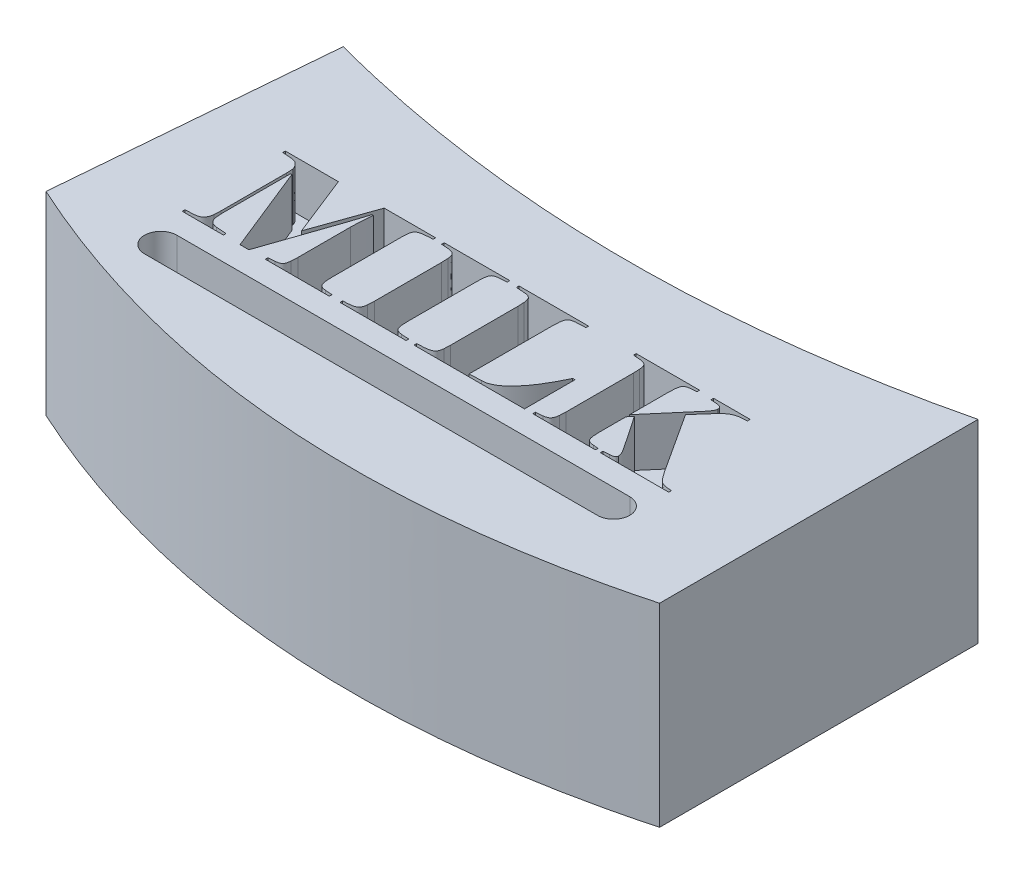
from build123d import *

# Parameters (mm, degrees)
BOSS_EXTRUDE1_DEPTH = 30.48
CUT_EXTRUDE1_DEPTH  = 7.62
SKETCH5_W           = 0.284935897
SKETCH5_H           = 2.320192308
SKETCH5_W_2         = 0.284935898
SKETCH5_H_2         = 3.256410256
CUT_EXTRUDE2_DEPTH  = 7.62
CUT_EXTRUDE3_DEPTH  = 15.24


with BuildPart() as part:
    # Sketch1 → Boss-Extrude1 (new body)
    with BuildSketch(Plane(origin=(0, 0, 0), x_dir=(1, 0, 0), z_dir=(0, 1, 0))):
        with BuildLine():
            Line((104.174952368, 42.174080227), (104.174952368, -7.827915506))
            add(Edge.make_bspline(
                [(0, 0), (49.417623471, -22.553771627), (104.174952368, -7.827915506)],
                knots=[0, 0, 0, 1, 1, 1], degree=2))
            Line((0, 0), (3.65048177, 43.025415545))
            add(Edge.make_bspline(
                [(3.65048177, 43.025415545), (53.087857537, 29.832692658), (104.174952368, 42.174080227)],
                knots=[0, 0, 0, 1, 1, 1], degree=2))
        make_face()
    extrude(amount=BOSS_EXTRUDE1_DEPTH)

    # Sketch2 → Cut-Extrude1 (cut)
    with BuildSketch(Plane(origin=(0, 30.48, 0), x_dir=(1, 0, 0), z_dir=(0, 1, 0))):
        with BuildLine():
            Line((16.79579589, 21.602120477), (16.79579589, 11.13742765))
            Line((16.79579589, 11.13742765), (16.840902325, 10.064538884))
            add(Edge.make_bspline(
                [(16.840902325, 10.064538884), (16.855310818, 9.951271918), (16.882521555, 9.737364909), (16.963560104, 9.440350461), (17.071528194, 9.185751), (17.212865002, 8.969886563), (17.4001947, 8.794697297), (17.641767838, 8.668410244), (17.926440796, 8.565971392), (18.137332085, 8.534615787), (18.248867462, 8.518032555)],
                knots=[0, 0, 0, 0, 1.180791605, 2.229949378, 3.175900595, 4.033087221, 4.882670352, 5.798347502, 6.835598461, 8, 8, 8, 8], degree=3))
            Line((18.248867462, 8.518032555), (19.863033443, 8.405266469))
            Line((19.863033443, 8.405266469), (19.863033443, 7.992864781))
            Line((19.863033443, 7.992864781), (13.396703855, 7.992864781))
            Line((13.396703855, 7.992864781), (13.396703855, 8.405266469))
            add(Edge.make_bspline(
                [(13.396703855, 8.405266469), (13.512654403, 8.412536722), (13.75409792, 8.427675551), (14.140285262, 8.434680181), (14.582254193, 8.466480019), (14.987786193, 8.508590057), (15.329401546, 8.576719314), (15.569068053, 8.66968946), (15.776891591, 8.80621234), (15.956971201, 8.978493607), (16.10265307, 9.19210614), (16.215610302, 9.443088637), (16.300736034, 9.731257059), (16.325374784, 9.93936279), (16.338287768, 10.048429443)],
                knots=[0, 0, 0, 0, 1.088681475, 2.266958535, 3.618688853, 5.240381737, 6.085350881, 6.875939365, 7.632479768, 8.401240364, 9.196937712, 10.039084781, 10.972299039, 12, 12, 12, 12], degree=3))
            Line((16.338287768, 10.048429443), (16.383394203, 11.111652545))
            Line((16.383394203, 11.111652545), (16.383394203, 21.408807186))
            Line((16.383394203, 21.408807186), (16.33506588, 22.426923853))
            add(Edge.make_bspline(
                [(16.33506588, 22.426923853), (16.306402965, 22.513882865), (16.250472812, 22.683566618), (16.12620791, 22.916199528), (15.990450227, 23.132012246), (15.824942796, 23.318623305), (15.640912401, 23.476982554), (15.44056532, 23.607287074), (15.215560008, 23.690474644), (14.898441998, 23.753342601), (14.49424637, 23.796948188), (14.094840672, 23.819721822), (13.794154822, 23.838505985), (13.599468927, 23.84552318), (13.435429878, 23.860475081), (13.335498797, 23.867264464), (13.290381544, 23.87032976)],
                knots=[0, 0, 0, 0, 1.040607395, 2.030544763, 2.993838035, 3.938318236, 4.857522136, 5.753242602, 6.643520453, 7.569370654, 9.429009052, 11.267416851, 12.124836776, 12.859487778, 13.485077342, 14, 14, 14, 14], degree=3))
            Line((13.290381544, 23.87032976), (13.290381544, 24.282731448))
            Line((13.290381544, 24.282731448), (21.628628169, 24.282731448))
            Line((21.628628169, 24.282731448), (25.417568675, 14.697614095))
            Line((25.417568675, 14.697614095), (28.819882599, 24.282731448))
            Line((28.819882599, 24.282731448), (36.900378169, 24.282731448))
            Line((36.900378169, 24.282731448), (36.900378169, 23.87032976))
            Line((36.900378169, 23.87032976), (36.388097947, 23.87032976))
            add(Edge.make_bspline(
                [(36.388097947, 23.87032976), (36.340839077, 23.868301293), (36.226918545, 23.863411542), (36.025804525, 23.851094398), (35.765108539, 23.822708689), (35.461428878, 23.791851935), (35.153953046, 23.747453099), (34.880712532, 23.675318462), (34.662135753, 23.576817252), (34.487865641, 23.452863269), (34.357694562, 23.286619329), (34.270097108, 23.074169735), (34.192463447, 22.821264509), (34.17038938, 22.633787711), (34.158551323, 22.533246163)],
                knots=[0, 0, 0, 0, 0.574857276, 1.38573024, 2.448042293, 3.761060899, 5.095696551, 6.219790428, 7.183303074, 7.995120805, 8.794143213, 9.711188391, 10.772537914, 12, 12, 12, 12], degree=3))
            Line((34.158551323, 22.533246163), (34.116666777, 21.602120477))
            Line((34.116666777, 21.602120477), (34.116666777, 10.908673589))
            Line((34.116666777, 10.908673589), (34.158551323, 9.871225593))
            add(Edge.make_bspline(
                [(34.158551323, 9.871225593), (34.171579831, 9.760314005), (34.195797157, 9.554152096), (34.257998274, 9.273516008), (34.340398601, 9.04519163), (34.448252442, 8.861112477), (34.608137462, 8.721668446), (34.819915399, 8.624114431), (35.083066641, 8.54212294), (35.279127061, 8.511943938), (35.386090722, 8.495479338)],
                knots=[0, 0, 0, 0, 1.288094477, 2.394303626, 3.308027556, 4.081698434, 4.827785203, 5.714472145, 6.753096487, 8, 8, 8, 8], degree=3))
            Line((35.386090722, 8.495479338), (36.497642146, 8.405266469))
            Line((36.497642146, 8.405266469), (36.497642146, 7.992864781))
            Line((36.497642146, 7.992864781), (26.435685342, 7.992864781))
            Line((26.435685342, 7.992864781), (26.435685342, 8.405266469))
            Line((26.435685342, 8.405266469), (27.473133338, 8.472926121))
            add(Edge.make_bspline(
                [(27.473133338, 8.472926121), (27.582920835, 8.489389111), (27.783872718, 8.519522495), (28.055116766, 8.58534075), (28.262574512, 8.679456825), (28.427484537, 8.793638016), (28.533962178, 8.968432604), (28.615095479, 9.190213873), (28.672987315, 9.475081226), (28.697117781, 9.685215511), (28.710338401, 9.800344053)],
                knots=[0, 0, 0, 0, 1.287597348, 2.35678124, 3.220361743, 3.922644693, 4.640971293, 5.547472163, 6.656307056, 8, 8, 8, 8], degree=3))
            Line((28.710338401, 9.800344053), (28.755444836, 10.81846072))
            Line((28.755444836, 10.81846072), (28.755444836, 19.037497481))
            add(Edge.make_bspline(
                [(28.755444836, 19.037497481), (28.755864277, 19.156720244), (28.756744956, 19.407045731), (28.771648071, 19.797950743), (28.789650053, 20.221247074), (28.829998967, 20.817257997), (28.883298073, 21.556455972), (28.936132439, 22.143463296), (28.96164568, 22.426923853)],
                knots=[0, 0, 0, 0, 0.63174092, 1.326431708, 2.072751143, 2.876833313, 4.491850898, 6, 6, 6, 6], degree=3))
            Line((28.96164568, 22.426923853), (28.755444836, 22.426923853))
            Line((28.755444836, 22.426923853), (27.837206703, 19.559443367))
            Line((27.837206703, 19.559443367), (23.86461857, 7.992864781))
            Line((23.86461857, 7.992864781), (22.475984762, 7.992864781))
            Line((22.475984762, 7.992864781), (17.001996734, 21.602120477))
            Line((17.001996734, 21.602120477), (16.79579589, 21.602120477))
        make_face()
        with BuildLine():
            Line((48.54750396, 7.992864781), (38.17624589, 7.992864781))
            Line((38.17624589, 7.992864781), (38.17624589, 8.405266469))
            add(Edge.make_bspline(
                [(38.17624589, 8.405266469), (38.238534262, 8.40632636), (38.380311211, 8.408738818), (38.573761163, 8.412328381), (38.771491548, 8.424579714), (38.969972863, 8.445447223), (39.2118272, 8.470528964), (39.4821156, 8.503330758), (39.753787163, 8.547522986), (39.997443789, 8.623793821), (40.196182562, 8.728860881), (40.357547398, 8.865145165), (40.474736827, 9.046502978), (40.568175811, 9.269786078), (40.633043302, 9.543061937), (40.657096811, 9.742038618), (40.669987346, 9.848672376)],
                knots=[0, 0, 0, 0, 0.789504643, 1.79702176, 2.451582526, 3.299352473, 4.325902506, 5.53291431, 6.75024101, 7.809035357, 8.752954279, 9.582614002, 10.454618519, 11.46075579, 12.639191541, 14, 14, 14, 14], degree=3))
            Line((40.669987346, 9.848672376), (40.715093781, 10.866789042))
            Line((40.715093781, 10.866789042), (40.715093781, 21.408807186))
            Line((40.715093781, 21.408807186), (40.669987346, 22.426923853))
            add(Edge.make_bspline(
                [(40.669987346, 22.426923853), (40.658404814, 22.536815215), (40.636986149, 22.740028648), (40.573305431, 23.01747916), (40.489418132, 23.241574834), (40.379238556, 23.421838184), (40.219907386, 23.555934837), (40.01135974, 23.655669312), (39.748844998, 23.737063184), (39.552632328, 23.764927217), (39.445669836, 23.780116891)],
                knots=[0, 0, 0, 0, 1.286399132, 2.378836497, 3.30580034, 4.065758715, 4.810741072, 5.694751535, 6.743327228, 8, 8, 8, 8], degree=3))
            Line((39.445669836, 23.780116891), (38.243905542, 23.87032976))
            Line((38.243905542, 23.87032976), (38.243905542, 24.282731448))
            Line((38.243905542, 24.282731448), (48.54750396, 24.282731448))
            Line((48.54750396, 24.282731448), (48.54750396, 23.87032976))
            Line((48.54750396, 23.87032976), (47.345739667, 23.802670108))
            add(Edge.make_bspline(
                [(47.345739667, 23.802670108), (47.238990041, 23.79020542), (47.043934193, 23.767429601), (46.779786982, 23.700241305), (46.570380127, 23.611190202), (46.408712656, 23.486711115), (46.296718579, 23.311776106), (46.217950027, 23.084525907), (46.154449112, 22.798945043), (46.130980708, 22.587292295), (46.118200268, 22.472030287)],
                knots=[0, 0, 0, 0, 1.246782035, 2.278154386, 3.154322115, 3.872926938, 4.609589167, 5.529054493, 6.654370696, 8, 8, 8, 8], degree=3))
            Line((46.118200268, 22.472030287), (46.076315722, 21.450691732))
            Line((46.076315722, 21.450691732), (46.076315722, 10.824904496))
            Line((46.076315722, 10.824904496), (46.118200268, 9.803565941))
            add(Edge.make_bspline(
                [(46.118200268, 9.803565941), (46.130312655, 9.691361971), (46.152671169, 9.484242263), (46.224742413, 9.205710215), (46.309444672, 8.98039383), (46.432087596, 8.807241297), (46.603307786, 8.685043629), (46.817606191, 8.592029626), (47.084572528, 8.518057562), (47.280850368, 8.488827228), (47.387624213, 8.472926121)],
                knots=[0, 0, 0, 0, 1.301156279, 2.401832208, 3.313663941, 4.067576686, 4.811533303, 5.710459504, 6.754505129, 8, 8, 8, 8], degree=3))
            Line((47.387624213, 8.472926121), (48.54750396, 8.405266469))
            Line((48.54750396, 8.405266469), (48.54750396, 7.992864781))
        make_face()
        with BuildLine():
            add(Edge.make_bspline(
                [(59.949766249, 8.472926121), (60.06171071, 8.47662354), (60.286016634, 8.484032153), (60.622022607, 8.545515148), (60.956139618, 8.642629127), (61.291949057, 8.775033653), (61.622769438, 8.952249121), (61.957562766, 9.161606138), (62.287669324, 9.415184812), (62.73095601, 9.799493007), (63.259612979, 10.335449378), (63.86885719, 11.016820748), (64.433429847, 11.751344311), (64.955250266, 12.532851691), (65.449053793, 13.346679576), (65.918108395, 14.185170182), (66.369414247, 15.04315659), (66.646932878, 15.629856775), (66.786612979, 15.925153494)],
                knots=[0, 0, 0, 0, 0.509346161, 1.020589684, 1.549823793, 2.091867224, 2.660493313, 3.256000877, 3.887721917, 4.55329516, 5.925866832, 7.311293249, 8.712726772, 10.139342848, 11.587513804, 13.045482177, 14.512938222, 16, 16, 16, 16], degree=3))
            Line((66.786612979, 15.925153494), (67.144242568, 15.925153494))
            Line((67.144242568, 15.925153494), (67.144242568, 7.992864781))
            Line((67.144242568, 7.992864781), (49.787930912, 7.992864781))
            Line((49.787930912, 7.992864781), (49.787930912, 8.405266469))
            add(Edge.make_bspline(
                [(49.787930912, 8.405266469), (49.860959545, 8.406331785), (50.030657133, 8.408807276), (50.262738808, 8.412384062), (50.498083287, 8.424109456), (50.727714317, 8.445404776), (50.999660082, 8.470034548), (51.299922458, 8.503330876), (51.599151263, 8.547601124), (51.8684403, 8.623257886), (52.089746208, 8.72917308), (52.273501147, 8.862697204), (52.413223484, 9.042368218), (52.514407604, 9.269340773), (52.591662975, 9.541720277), (52.616416593, 9.741812752), (52.629636291, 9.848672376)],
                knots=[0, 0, 0, 0, 0.84529083, 1.964213326, 2.686082439, 3.571715602, 4.632883893, 5.846263634, 7.068207395, 8.130176101, 9.069644986, 9.894961127, 10.735486619, 11.669595784, 12.75544487, 14, 14, 14, 14], degree=3))
            Line((52.629636291, 9.848672376), (52.674742726, 10.866789042))
            Line((52.674742726, 10.866789042), (52.674742726, 21.408807186))
            Line((52.674742726, 21.408807186), (52.629636291, 22.426923853))
            add(Edge.make_bspline(
                [(52.629636291, 22.426923853), (52.617066685, 22.536884072), (52.593807683, 22.740356233), (52.526227245, 23.017415089), (52.440653427, 23.243520796), (52.322509931, 23.418185479), (52.175772357, 23.550148068), (51.998730257, 23.650093972), (51.788529234, 23.720403815), (51.478747294, 23.771827194), (51.103644045, 23.815809256), (50.689037655, 23.834348973), (50.326912971, 23.849162151), (50.101509663, 23.863499646), (49.994131755, 23.87032976)],
                knots=[0, 0, 0, 0, 1.147575469, 2.123492127, 2.95349405, 3.642940923, 4.289999017, 4.984025789, 5.738355238, 6.577808332, 8.238298583, 9.656019474, 10.88337165, 12, 12, 12, 12], degree=3))
            Line((49.994131755, 23.87032976), (49.994131755, 24.282731448))
            Line((49.994131755, 24.282731448), (60.922776481, 24.282731448))
            Line((60.922776481, 24.282731448), (60.922776481, 23.87032976))
            Line((60.922776481, 23.87032976), (59.373048264, 23.802670108))
            add(Edge.make_bspline(
                [(59.373048264, 23.802670108), (59.265261074, 23.790152817), (59.064782812, 23.766871343), (58.792538532, 23.698380073), (58.573558173, 23.603069173), (58.400881638, 23.475297284), (58.281233877, 23.295406441), (58.188727124, 23.070131866), (58.119466232, 22.787796511), (58.096646809, 22.578755607), (58.08429299, 22.465586511)],
                knots=[0, 0, 0, 0, 1.234540546, 2.296177721, 3.182553996, 3.940675153, 4.70390553, 5.607732982, 6.704891285, 8, 8, 8, 8], degree=3))
            Line((58.08429299, 22.465586511), (58.035964667, 21.43780418))
            Line((58.035964667, 21.43780418), (58.035964667, 8.405266469))
            Line((58.035964667, 8.405266469), (59.949766249, 8.472926121))
        make_face()
        with BuildLine():
            Line((76.790575796, 15.593299011), (76.181638928, 14.88448361))
            Line((76.181638928, 14.88448361), (76.181638928, 10.824904496))
            Line((76.181638928, 10.824904496), (76.226745363, 9.803565941))
            add(Edge.make_bspline(
                [(76.226745363, 9.803565941), (76.239714682, 9.691592188), (76.263596394, 9.485403651), (76.325495917, 9.205095075), (76.40998012, 8.983242302), (76.520241251, 8.806751287), (76.685937327, 8.685195901), (76.896306547, 8.590045795), (77.164352367, 8.518522876), (77.3626178, 8.48898358), (77.470394203, 8.472926121)],
                knots=[0, 0, 0, 0, 1.309337591, 2.411015016, 3.323902298, 4.061010509, 4.789835148, 5.671756282, 6.734374785, 8, 8, 8, 8], degree=3))
            Line((77.470394203, 8.472926121), (78.282310025, 8.405266469))
            Line((78.282310025, 8.405266469), (78.282310025, 7.992864781))
            Line((78.282310025, 7.992864781), (68.439441618, 7.992864781))
            Line((68.439441618, 7.992864781), (68.439441618, 8.405266469))
            Line((68.439441618, 8.405266469), (69.550993042, 8.495479338))
            add(Edge.make_bspline(
                [(69.550993042, 8.495479338), (69.651607295, 8.510586918), (69.839722481, 8.538833069), (70.091329846, 8.624298608), (70.299990188, 8.724668554), (70.461682051, 8.864406063), (70.580173011, 9.046330134), (70.673461133, 9.269844037), (70.738378423, 9.54304371), (70.762424174, 9.742032259), (70.775310553, 9.848672376)],
                knots=[0, 0, 0, 0, 1.193949577, 2.232288559, 3.113420806, 3.901084107, 4.710221723, 5.643821832, 6.737298615, 8, 8, 8, 8], degree=3))
            Line((70.775310553, 9.848672376), (70.820416988, 10.866789042))
            Line((70.820416988, 10.866789042), (70.820416988, 21.408807186))
            Line((70.820416988, 21.408807186), (70.775310553, 22.426923853))
            add(Edge.make_bspline(
                [(70.775310553, 22.426923853), (70.76372802, 22.536815215), (70.742309356, 22.740028648), (70.678628638, 23.01747916), (70.594741339, 23.241574834), (70.484561763, 23.421838184), (70.325230593, 23.555934837), (70.116682947, 23.655669312), (69.854168205, 23.737063184), (69.657955534, 23.764927217), (69.550993042, 23.780116891)],
                knots=[0, 0, 0, 0, 1.286399132, 2.378836497, 3.30580034, 4.065758715, 4.810741072, 5.694751535, 6.743327228, 8, 8, 8, 8], degree=3))
            Line((69.550993042, 23.780116891), (68.394335184, 23.87032976))
            Line((68.394335184, 23.87032976), (68.394335184, 24.282731448))
            Line((68.394335184, 24.282731448), (78.349969677, 24.282731448))
            Line((78.349969677, 24.282731448), (78.349969677, 23.87032976))
            Line((78.349969677, 23.87032976), (77.470394203, 23.802670108))
            add(Edge.make_bspline(
                [(77.470394203, 23.802670108), (77.362653667, 23.789982425), (77.164595546, 23.76665881), (76.896377223, 23.701694999), (76.685267739, 23.609996414), (76.520360753, 23.488023937), (76.409212105, 23.310959067), (76.325251107, 23.085459405), (76.263435225, 22.798760057), (76.239681295, 22.587227073), (76.226745363, 22.472030287)],
                knots=[0, 0, 0, 0, 1.2511946, 2.300055861, 3.170701665, 3.894494799, 4.626514318, 5.544627283, 6.662851337, 8, 8, 8, 8], degree=3))
            Line((76.226745363, 22.472030287), (76.181638928, 21.450691732))
            Line((76.181638928, 21.450691732), (76.181638928, 15.461201595))
            add(Edge.make_bspline(
                [(76.181638928, 15.461201595), (76.299900445, 15.598561213), (76.557324524, 15.897556813), (76.971841084, 16.384857009), (77.452257558, 16.941947402), (78.185392021, 17.785773313), (79.152155201, 18.910827519), (80.036685151, 19.936966665), (80.620385826, 20.616329979), (80.884785809, 20.928699211), (81.123202268, 21.216352251), (81.338231674, 21.476056218), (81.529294208, 21.708324164), (81.694066881, 21.914209702), (81.832426522, 22.095649479), (81.982883726, 22.293592139), (82.132120149, 22.513459438), (82.261886692, 22.758126282), (82.349436909, 22.977465886), (82.361924693, 23.119011379), (82.367664245, 23.184067576)],
                knots=[0, 0, 0, 0, 0.984050981, 2.142019025, 3.473273169, 4.977829918, 8.210788353, 11.526589373, 12.332928682, 13.073513282, 13.748384472, 14.361296648, 14.9040486, 15.381201161, 15.792871609, 16.142710719, 16.731346717, 17.232104334, 17.647064908, 18, 18, 18, 18], degree=3))
            add(Edge.make_bspline(
                [(82.367664245, 23.184067576), (82.365980412, 23.23279388), (82.362834888, 23.323818212), (82.318610108, 23.449798615), (82.246147709, 23.552704656), (82.144016796, 23.63208279), (82.020150812, 23.689595031), (81.878873845, 23.743985904), (81.71602112, 23.780418509), (81.599916216, 23.795065796), (81.539638981, 23.802670108)],
                knots=[0, 0, 0, 0, 1.00911869, 1.88510822, 2.734200068, 3.59235149, 4.541336496, 5.566154621, 6.736440385, 8, 8, 8, 8], degree=3))
            Line((81.539638981, 23.802670108), (80.540853644, 23.87032976))
            Line((80.540853644, 23.87032976), (80.540853644, 24.282731448))
            Line((80.540853644, 24.282731448), (86.285480279, 24.282731448))
            Line((86.285480279, 24.282731448), (86.285480279, 23.87032976))
            add(Edge.make_bspline(
                [(86.285480279, 23.87032976), (86.185623969, 23.863448837), (85.981694548, 23.849396418), (85.660136738, 23.835881411), (85.297470205, 23.809184581), (84.883962004, 23.73857292), (84.423271173, 23.610727844), (84.027268632, 23.425689488), (83.697411545, 23.214485081), (83.424624137, 22.995167651), (83.12694539, 22.723552505), (82.930084774, 22.515335286), (82.825172367, 22.404370635)],
                knots=[0, 0, 0, 0, 0.769428664, 1.571349293, 2.4743443, 3.562919176, 4.791133496, 6.139333251, 6.904274894, 7.797860284, 8.82641952, 10, 10, 10, 10], degree=3))
            Line((82.825172367, 22.404370635), (80.563406861, 19.85585708))
            Line((80.563406861, 19.85585708), (86.649553644, 10.489828125))
            add(Edge.make_bspline(
                [(86.649553644, 10.489828125), (86.716963835, 10.389777076), (86.84646721, 10.19756655), (87.035376128, 9.925768821), (87.20810866, 9.682285559), (87.371887444, 9.473534508), (87.513710271, 9.288488801), (87.647053514, 9.137722784), (87.762208943, 9.013144513), (87.896824598, 8.890407308), (88.063676537, 8.77373831), (88.265216632, 8.658770146), (88.478742887, 8.577816249), (88.693763616, 8.525766817), (88.899112279, 8.492780196), (89.081961152, 8.467903007), (89.238460448, 8.446189719), (89.408497097, 8.435105535), (89.590493773, 8.427929187), (89.727585703, 8.412425881), (89.790894625, 8.405266469)],
                knots=[0, 0, 0, 0, 1.620462069, 3.113109465, 4.446317644, 5.629331285, 6.676975143, 7.576718002, 8.331843074, 8.954835872, 10.019719162, 11.059386932, 12.064036212, 13.075189481, 14.026206895, 14.856543771, 15.554376826, 16.147420886, 17.144480738, 18, 18, 18, 18], degree=3))
            Line((89.790894625, 8.405266469), (89.790894625, 7.992864781))
            Line((89.790894625, 7.992864781), (79.049119414, 7.992864781))
            Line((79.049119414, 7.992864781), (79.049119414, 8.405266469))
            Line((79.049119414, 8.405266469), (79.999576428, 8.450372903))
            add(Edge.make_bspline(
                [(79.999576428, 8.450372903), (80.073720759, 8.458540597), (80.211570489, 8.473726038), (80.402435701, 8.500923283), (80.561668621, 8.537031833), (80.694727962, 8.575199845), (80.803081339, 8.637234427), (80.877322048, 8.734303478), (80.919715364, 8.860578068), (80.922653844, 8.953693814), (80.924258338, 9.004537671)],
                knots=[0, 0, 0, 0, 1.463212469, 2.72041629, 3.778283793, 4.664261208, 5.430165427, 6.180264039, 7.00637218, 8, 8, 8, 8], degree=3))
            add(Edge.make_bspline(
                [(80.924258338, 9.004537671), (80.917115844, 9.080192594), (80.900977697, 9.25113151), (80.82634821, 9.474040036), (80.7339148, 9.691088687), (80.61601545, 9.896803956), (80.470062816, 10.144155347), (80.211407201, 10.535891958), (79.844452151, 11.088390963), (79.447831252, 11.684981057), (79.08737072, 12.219703881), (78.77231718, 12.692020908), (78.410709992, 13.219180513), (78.087501966, 13.688874186), (77.822807557, 14.075894873), (77.63269284, 14.352961954), (77.456326185, 14.609474675), (77.294151595, 14.845016323), (77.149228729, 15.061652879), (77.018369954, 15.257954438), (76.897707651, 15.431299766), (76.82475183, 15.541619781), (76.790575796, 15.593299011)],
                knots=[0, 0, 0, 0, 0.581904074, 1.314786247, 1.791147351, 2.392583817, 3.132114421, 3.996587038, 5.995224487, 8.224819922, 9.496269237, 10.946085175, 12.58351079, 14.403949169, 15.32329962, 16.18319911, 16.983648368, 17.713183605, 18.378636018, 18.984632938, 19.524352974, 20, 20, 20, 20], degree=3))
        make_face()
    extrude(amount=-CUT_EXTRUDE1_DEPTH, mode=Mode.SUBTRACT)

    # Sketch5 → Cut-Extrude2 (cut)
    # profile 1 of 19: a face of its own
    with BuildSketch(Plane.XZ):
        Polygon((4.397806143, -3.640705815), (4.692282304, -3.640705815), (5.313671527, -5.969166352), (6.237805141, -3.640705815), (6.279146287, -3.640705815), (7.186107425, -5.953265911), (7.810676736, -3.640705815), (8.101972809, -3.640705815), (7.245893082, -6.815705815), (7.205187953, -6.815705815), (6.249889476, -4.387390511), (5.283142681, -6.815705815), (5.242437553, -6.815705815), align=None)
    # profile 2 of 19: a face of its own
    with BuildSketch(Plane.XZ):
        with BuildLine():
            add(Edge.make_bspline(
                [(8.690925133, -3.51859043), (8.708606541, -3.519410626), (8.743230133, -3.521016726), (8.793298312, -3.534770352), (8.838888602, -3.558083638), (8.879326973, -3.589361634), (8.914026899, -3.626145772), (8.938320829, -3.669018222), (8.953934932, -3.715335701), (8.955820478, -3.747643675), (8.956780502, -3.764093235)],
                knots=[0, 0, 0, 0, 1.055194115, 2.066272739, 3.074728998, 4.095836921, 5.109056067, 6.073838105, 7.019297344, 8, 8, 8, 8], degree=3))
            add(Edge.make_bspline(
                [(8.956780502, -3.764093235), (8.955798828, -3.780115785), (8.953858176, -3.811790469), (8.93833289, -3.857304976), (8.91381986, -3.899581719), (8.879349224, -3.936294434), (8.838882705, -3.96755514), (8.793299878, -3.99087301), (8.743229721, -4.00462542), (8.708606402, -4.006231688), (8.690925133, -4.007051969)],
                knots=[0, 0, 0, 0, 0.96129708, 1.900370562, 2.859976407, 3.87933698, 4.906634145, 5.921202961, 6.938410037, 8, 8, 8, 8], degree=3))
            add(Edge.make_bspline(
                [(8.690925133, -4.007051969), (8.673446055, -4.006263008), (8.639425313, -4.0047274), (8.59010682, -3.99060317), (8.544905262, -3.96754716), (8.504388023, -3.936499121), (8.470614919, -3.89935625), (8.446032867, -3.857330776), (8.430543437, -3.8117839), (8.428597953, -3.780113578), (8.427613835, -3.764093235)],
                knots=[0, 0, 0, 0, 1.054934014, 2.053291228, 3.073705704, 4.106921865, 5.123545215, 6.088680038, 7.033164197, 8, 8, 8, 8], degree=3))
            add(Edge.make_bspline(
                [(8.427613835, -3.764093235), (8.428576392, -3.747645964), (8.430466915, -3.715342487), (8.446044478, -3.668991993), (8.47041016, -3.626373059), (8.504410386, -3.58915707), (8.54489931, -3.558091569), (8.590108358, -3.535040178), (8.639424907, -3.520914749), (8.673445917, -3.519379306), (8.690925133, -3.51859043)],
                knots=[0, 0, 0, 0, 0.98631895, 1.937192651, 2.907499808, 3.917963147, 4.944918757, 5.95915025, 6.951458133, 8, 8, 8, 8], degree=3))
        make_face()
    # profile 3 of 19: a face of its own
    with BuildSketch(Plane.XZ):
        with Locations((8.692197168, -5.655609661)):
            Rectangle(SKETCH5_W, SKETCH5_H)
    # profile 4 of 19: a face of its own
    with BuildSketch(Plane.XZ):
        with Locations((9.628415117, -5.187500687)):
            Rectangle(SKETCH5_W_2, SKETCH5_H_2)
    # profile 5 of 19: a face of its own
    with BuildSketch(Plane.XZ):
        with Locations((10.523927938, -5.187500687)):
            Rectangle(SKETCH5_W, SKETCH5_H_2)
    # profile 6 of 19: a face of its own
    with BuildSketch(Plane.XZ):
        with BuildLine():
            Line((12.62024204, -3.640705815), (13.23972321, -3.640705815))
            add(Edge.make_bspline(
                [(13.23972321, -3.640705815), (13.270047615, -3.640865246), (13.328823859, -3.641174262), (13.414294353, -3.645966817), (13.494348631, -3.652501575), (13.569009911, -3.662870301), (13.638243691, -3.675381414), (13.702258619, -3.690532347), (13.760851132, -3.708699346), (13.8308034, -3.737588473), (13.91056, -3.780517347), (13.996918542, -3.843952545), (14.070763816, -3.921542708), (14.134432832, -4.00906626), (14.185052419, -4.105346567), (14.221673139, -4.208088831), (14.244857783, -4.31596784), (14.247242148, -4.390029866), (14.248447168, -4.427459621)],
                knots=[0, 0, 0, 0, 1.001505555, 1.941167018, 2.826882275, 3.653841531, 4.429895133, 5.150066043, 5.825578002, 6.45369114, 7.647487171, 8.808567382, 9.977351308, 11.170798116, 12.373658725, 13.556498008, 14.765093433, 16, 16, 16, 16], degree=3))
            add(Edge.make_bspline(
                [(14.248447168, -4.427459621), (14.247455463, -4.462523011), (14.245506668, -4.531425879), (14.226871451, -4.632204106), (14.19769713, -4.728135569), (14.157143083, -4.818870162), (14.104436272, -4.902357796), (14.04197194, -4.979271959), (13.966609412, -5.046356132), (13.910145902, -5.083860051), (13.881464997, -5.102910342)],
                knots=[0, 0, 0, 0, 1.044552857, 2.05264487, 3.044412934, 4.028983338, 5.005914585, 5.980388656, 6.974128949, 8, 8, 8, 8], degree=3))
            add(Edge.make_bspline(
                [(13.881464997, -5.102910342), (13.917533385, -5.116757877), (13.986541145, -5.143251641), (14.081506314, -5.190092384), (14.163325923, -5.241039441), (14.232629049, -5.296676191), (14.291899636, -5.356646326), (14.343654804, -5.42182918), (14.387815765, -5.493075053), (14.425655345, -5.569641117), (14.455181717, -5.650745556), (14.477294145, -5.735627618), (14.489964616, -5.823982928), (14.491767691, -5.884113237), (14.492677937, -5.914468836)],
                knots=[0, 0, 0, 0, 1.27268992, 2.434971085, 3.483601985, 4.442670788, 5.356604649, 6.2567628, 7.179492994, 8.113709626, 9.066344395, 10.018646069, 10.999752585, 12, 12, 12, 12], degree=3))
            add(Edge.make_bspline(
                [(14.492677937, -5.914468836), (14.491791799, -5.94546307), (14.490048295, -6.006445094), (14.477185035, -6.096030109), (14.455405345, -6.181641667), (14.425405091, -6.263833512), (14.386250706, -6.342446634), (14.338600338, -6.417570094), (14.281784563, -6.488449094), (14.218227532, -6.555871238), (14.146325442, -6.616493588), (14.068750436, -6.670482836), (13.98452556, -6.714883907), (13.895034109, -6.752182012), (13.799272193, -6.780672828), (13.697669828, -6.800605091), (13.59031464, -6.814035375), (13.516645794, -6.815139554), (13.478865838, -6.815705815)],
                knots=[0, 0, 0, 0, 0.978564426, 1.925352924, 2.850884081, 3.763762016, 4.682927383, 5.618979971, 6.567305752, 7.547517671, 8.540179244, 9.531824382, 10.526200242, 11.540722885, 12.589160233, 13.674978461, 14.80764778, 16, 16, 16, 16], degree=3))
            Line((13.478865838, -6.815705815), (12.62024204, -6.815705815))
            Line((12.62024204, -6.815705815), (12.62024204, -3.640705815))
        make_face()
        with BuildLine():
            Line((12.905177937, -3.966346841), (12.905177937, -4.983975046))
            Line((12.905177937, -4.983975046), (13.096619244, -4.983975046))
            add(Edge.make_bspline(
                [(13.096619244, -4.983975046), (13.124603508, -4.983612259), (13.17867481, -4.98291128), (13.256979287, -4.980903303), (13.329664125, -4.975280793), (13.396603859, -4.969659898), (13.457693076, -4.960520807), (13.512796436, -4.949642239), (13.562778735, -4.938137032), (13.62041818, -4.918570426), (13.68579864, -4.889652821), (13.755497242, -4.844774798), (13.816942082, -4.791321992), (13.868828103, -4.729644477), (13.911292794, -4.661730151), (13.940787378, -4.588662624), (13.960787415, -4.512262932), (13.962594018, -4.459813517), (13.963511271, -4.43318378)],
                knots=[0, 0, 0, 0, 1.156816544, 2.235205308, 3.236616184, 4.169592532, 5.011045266, 5.787822928, 6.49130361, 7.128639758, 8.301311294, 9.436451833, 10.541879658, 11.654887649, 12.756523258, 13.837046038, 14.901820046, 16, 16, 16, 16], degree=3))
            add(Edge.make_bspline(
                [(13.963511271, -4.43318378), (13.96303395, -4.41556183), (13.962097634, -4.380994451), (13.954429281, -4.330603251), (13.941395838, -4.283210704), (13.924655158, -4.238167333), (13.901261133, -4.196881583), (13.873717134, -4.15792597), (13.840437972, -4.122627119), (13.802558124, -4.089634789), (13.759007445, -4.060384396), (13.709811916, -4.034765989), (13.654305952, -4.014136856), (13.593425005, -3.99607006), (13.526231947, -3.98338068), (13.453502173, -3.972809392), (13.374639964, -3.967427548), (13.320079764, -3.966715111), (13.291876655, -3.966346841)],
                knots=[0, 0, 0, 0, 0.91205012, 1.789085906, 2.630437955, 3.453916878, 4.269457761, 5.079663411, 5.91843418, 6.774407191, 7.675494373, 8.627863946, 9.638891023, 10.736472738, 11.911756761, 13.175263542, 14.539845004, 16, 16, 16, 16], degree=3))
            Line((13.291876655, -3.966346841), (12.905177937, -3.966346841))
        make_face(mode=Mode.SUBTRACT)
        with BuildLine():
            Line((12.905177937, -5.309616071), (12.905177937, -6.490064789))
            Line((12.905177937, -6.490064789), (13.310957184, -6.490064789))
            add(Edge.make_bspline(
                [(13.310957184, -6.490064789), (13.340002924, -6.489716676), (13.395984759, -6.489045732), (13.476812303, -6.486855386), (13.551726976, -6.481873108), (13.620386928, -6.474030087), (13.683533553, -6.465522494), (13.740409326, -6.45408226), (13.791475294, -6.440974989), (13.850688416, -6.420714704), (13.917366599, -6.389240049), (13.989222161, -6.341783572), (14.053108802, -6.285247428), (14.107360716, -6.219814385), (14.151822498, -6.148665967), (14.18416709, -6.073241256), (14.204115938, -5.994786528), (14.206530906, -5.941295296), (14.20774204, -5.914468836)],
                knots=[0, 0, 0, 0, 1.160039823, 2.235823828, 3.228722157, 4.157150951, 4.99529583, 5.772374946, 6.472645482, 7.099169577, 8.269452708, 9.405989375, 10.527446681, 11.663510218, 12.788923519, 13.866172445, 14.929861265, 16, 16, 16, 16], degree=3))
            add(Edge.make_bspline(
                [(14.20774204, -5.914468836), (14.207491574, -5.897692734), (14.206994682, -5.864411131), (14.199501124, -5.81550178), (14.188602828, -5.768125452), (14.174513599, -5.722153502), (14.153994511, -5.678417082), (14.130040002, -5.636051189), (14.101953587, -5.594999818), (14.058189237, -5.543100131), (13.994533222, -5.483303984), (13.904084933, -5.42475925), (13.801240063, -5.377544453), (13.72664798, -5.357497071), (13.688115638, -5.347141112)],
                knots=[0, 0, 0, 0, 0.723448775, 1.435228256, 2.130040452, 2.821711965, 3.505591119, 4.210454504, 4.921174351, 5.648778258, 7.137944449, 8.670945889, 10.280296675, 12, 12, 12, 12], degree=3))
            add(Edge.make_bspline(
                [(13.688115638, -5.347141112), (13.672667815, -5.344006857), (13.639173749, -5.337211146), (13.584556873, -5.330037729), (13.52220362, -5.323646854), (13.45197001, -5.318919589), (13.373767183, -5.314033225), (13.287428121, -5.312132923), (13.193305414, -5.309865737), (13.127998048, -5.309701422), (13.094075173, -5.309616071)],
                knots=[0, 0, 0, 0, 0.634451884, 1.375622551, 2.216452059, 3.157844607, 4.20941857, 5.370758133, 6.634282058, 8, 8, 8, 8], degree=3))
            Line((13.094075173, -5.309616071), (12.905177937, -5.309616071))
        make_face(mode=Mode.SUBTRACT)
    # profile 7 of 19: a face of its own
    with BuildSketch(Plane.XZ):
        with BuildLine():
            Line((15.021844604, -4.495513507), (15.306780502, -4.495513507))
            Line((15.306780502, -4.495513507), (15.306780502, -5.571655334))
            add(Edge.make_bspline(
                [(15.306780502, -5.571655334), (15.30690923, -5.603244542), (15.30715548, -5.663673218), (15.308825477, -5.750627566), (15.31275349, -5.829927013), (15.317664602, -5.901617367), (15.323980254, -5.9656865), (15.331494446, -6.021910631), (15.339893157, -6.070927355), (15.348114333, -6.100448828), (15.351937753, -6.114178371)],
                knots=[0, 0, 0, 0, 1.388932606, 2.656963016, 3.823490214, 4.879454478, 5.816252168, 6.653371382, 7.373723809, 8, 8, 8, 8], degree=3))
            add(Edge.make_bspline(
                [(15.351937753, -6.114178371), (15.358071359, -6.131434833), (15.370211054, -6.165588998), (15.392230571, -6.214927596), (15.419470562, -6.260625173), (15.44927912, -6.304443868), (15.483659297, -6.34508567), (15.522176103, -6.382481948), (15.563540218, -6.41804566), (15.625003704, -6.460123292), (15.709058895, -6.505222199), (15.819415323, -6.544134834), (15.939071299, -6.567390185), (16.021770723, -6.57008826), (16.064277497, -6.571475046)],
                knots=[0, 0, 0, 0, 0.725840625, 1.436591201, 2.137033971, 2.831655856, 3.53531722, 4.242432219, 4.957935707, 5.694543706, 7.190802206, 8.724350549, 10.316345118, 12, 12, 12, 12], degree=3))
            add(Edge.make_bspline(
                [(16.064277497, -6.571475046), (16.106780322, -6.57005877), (16.189015424, -6.567318539), (16.307356717, -6.544836329), (16.415534786, -6.507275454), (16.512463863, -6.454835873), (16.597704304, -6.390662716), (16.668737598, -6.315361869), (16.727345608, -6.231315639), (16.752935582, -6.168610043), (16.765804941, -6.137075006)],
                knots=[0, 0, 0, 0, 1.157059328, 2.238695713, 3.266970494, 4.264342957, 5.228770407, 6.160125903, 7.074715775, 8, 8, 8, 8], degree=3))
            add(Edge.make_bspline(
                [(16.765804941, -6.137075006), (16.769609707, -6.124405578), (16.778021115, -6.096396566), (16.787058391, -6.048880652), (16.795199509, -5.992216332), (16.802151105, -5.926032814), (16.807108788, -5.850503054), (16.809781255, -5.765650657), (16.812800476, -5.671741994), (16.812846302, -5.606003384), (16.812870245, -5.571655334)],
                knots=[0, 0, 0, 0, 0.557542046, 1.232589297, 2.036731608, 2.971723315, 4.038036528, 5.22795436, 6.551621927, 8, 8, 8, 8], degree=3))
            Line((16.812870245, -5.571655334), (16.812870245, -4.495513507))
            Line((16.812870245, -4.495513507), (17.097806143, -4.495513507))
            Line((17.097806143, -4.495513507), (17.097806143, -5.625080815))
            add(Edge.make_bspline(
                [(17.097806143, -5.625080815), (17.097405462, -5.663459463), (17.096628088, -5.737919291), (17.09163214, -5.846127021), (17.083059992, -5.946967057), (17.070049128, -6.040492778), (17.054749551, -6.12663278), (17.035013504, -6.205497463), (17.011447531, -6.276843844), (16.984863242, -6.341923884), (16.953456262, -6.40093071), (16.920048894, -6.456933915), (16.881472851, -6.508543934), (16.840859853, -6.558329873), (16.795682636, -6.603815402), (16.746787764, -6.64604424), (16.694863433, -6.685661919), (16.638757375, -6.721123294), (16.579288661, -6.753069822), (16.516383876, -6.781387265), (16.449272542, -6.803796031), (16.378820529, -6.823127849), (16.304682665, -6.838290261), (16.226930422, -6.84898236), (16.145589992, -6.855536768), (16.090154982, -6.856114658), (16.061733426, -6.856410943)],
                knots=[0, 0, 0, 0, 1.493040784, 2.896703357, 4.213163133, 5.428574705, 6.569057535, 7.615249723, 8.588095153, 9.490268104, 10.346124644, 11.18633936, 12.024365274, 12.850166724, 13.684164916, 14.514361689, 15.362232829, 16.222528818, 17.093394965, 17.986930858, 18.902426812, 19.842810585, 20.827885679, 21.843828298, 22.894529745, 24, 24, 24, 24], degree=3))
            add(Edge.make_bspline(
                [(16.061733426, -6.856410943), (16.033524446, -6.85610278), (15.978091173, -6.855497212), (15.896746544, -6.849018572), (15.81877888, -6.838306874), (15.744465375, -6.823016784), (15.673731458, -6.803931342), (15.606290611, -6.781249563), (15.542932522, -6.753055126), (15.48289599, -6.721325485), (15.426650966, -6.685434128), (15.373938185, -6.646093121), (15.324828326, -6.603361192), (15.279310557, -6.557416804), (15.238023785, -6.507690011), (15.200453519, -6.454580825), (15.166021365, -6.398615473), (15.134858477, -6.338686747), (15.108087098, -6.272853567), (15.084451268, -6.200012628), (15.065119475, -6.119365345), (15.049387378, -6.030980667), (15.036731429, -5.935281594), (15.027944714, -5.831714531), (15.023031782, -5.720531754), (15.022248862, -5.64374221), (15.021844604, -5.604092233)],
                knots=[0, 0, 0, 0, 1.083640291, 2.129454052, 3.13281866, 4.105697902, 5.042300162, 5.946461698, 6.836384745, 7.703652036, 8.553297018, 9.397182691, 10.228592656, 11.052265423, 11.879314572, 12.708807002, 13.549817954, 14.402308542, 15.300838682, 16.27712199, 17.341985831, 18.484375296, 19.725102775, 21.0496083, 22.476576903, 24, 24, 24, 24], degree=3))
            Line((15.021844604, -5.604092233), (15.021844604, -4.495513507))
        make_face()
    # profile 8 of 19: a face of its own
    with BuildSketch(Plane.XZ):
        Polygon((17.545562553, -4.495513507), (19.295883066, -4.495513507), (17.946253659, -6.530769918), (19.255177937, -6.530769918), (19.255177937, -6.815705815), (17.423447168, -6.815705815), (18.773712593, -4.780449405), (17.545562553, -4.780449405), align=None)
    # profile 9 of 19: a face of its own
    with BuildSketch(Plane.XZ):
        with BuildLine():
            add(Edge.make_bspline(
                [(19.722014877, -3.51859043), (19.739696284, -3.519410626), (19.774319877, -3.521016726), (19.824388056, -3.534770352), (19.869978345, -3.558083638), (19.910416717, -3.589361634), (19.945116643, -3.626145772), (19.969410573, -3.669018222), (19.985024675, -3.715335701), (19.986910222, -3.747643675), (19.987870245, -3.764093235)],
                knots=[0, 0, 0, 0, 1.055194115, 2.066272739, 3.074728998, 4.095836921, 5.109056067, 6.073838105, 7.019297344, 8, 8, 8, 8], degree=3))
            add(Edge.make_bspline(
                [(19.987870245, -3.764093235), (19.986888572, -3.780115785), (19.984947919, -3.811790469), (19.969422633, -3.857304976), (19.944909603, -3.899581719), (19.910438968, -3.936294434), (19.869972449, -3.96755514), (19.824389622, -3.99087301), (19.774319465, -4.00462542), (19.739696145, -4.006231688), (19.722014877, -4.007051969)],
                knots=[0, 0, 0, 0, 0.96129708, 1.900370562, 2.859976407, 3.87933698, 4.906634145, 5.921202961, 6.938410037, 8, 8, 8, 8], degree=3))
            add(Edge.make_bspline(
                [(19.722014877, -4.007051969), (19.704535798, -4.006263008), (19.670515056, -4.0047274), (19.621196564, -3.99060317), (19.575995005, -3.96754716), (19.535477767, -3.936499121), (19.501704663, -3.89935625), (19.477122611, -3.857330776), (19.461633181, -3.8117839), (19.459687696, -3.780113578), (19.458703578, -3.764093235)],
                knots=[0, 0, 0, 0, 1.054934014, 2.053291228, 3.073705704, 4.106921865, 5.123545215, 6.088680038, 7.033164197, 8, 8, 8, 8], degree=3))
            add(Edge.make_bspline(
                [(19.458703578, -3.764093235), (19.459666136, -3.747645964), (19.461556659, -3.715342487), (19.477134221, -3.668991993), (19.501499904, -3.626373059), (19.535500129, -3.58915707), (19.575989054, -3.558091569), (19.621198101, -3.535040178), (19.67051465, -3.520914749), (19.704535661, -3.519379306), (19.722014877, -3.51859043)],
                knots=[0, 0, 0, 0, 0.98631895, 1.937192651, 2.907499808, 3.917963147, 4.944918757, 5.95915025, 6.951458133, 8, 8, 8, 8], degree=3))
        make_face()
    # profile 10 of 19: a face of its own
    with BuildSketch(Plane.XZ):
        with Locations((19.723286912, -5.655609661)):
            Rectangle(SKETCH5_W_2, SKETCH5_H)
    # profile 11 of 19: a face of its own
    with BuildSketch(Plane.XZ):
        with BuildLine():
            Line((22.918639476, -4.495513507), (22.918639476, -6.815705815))
            Line((22.918639476, -6.815705815), (22.633703578, -6.815705815))
            Line((22.633703578, -6.815705815), (22.633703578, -6.414378692))
            add(Edge.make_bspline(
                [(22.633703578, -6.414378692), (22.601573676, -6.450700323), (22.538871766, -6.521582444), (22.43415018, -6.614185558), (22.323144762, -6.69072875), (22.206394278, -6.752550459), (22.084004157, -6.798988967), (21.956245706, -6.831996411), (21.823066811, -6.853217962), (21.732123603, -6.855337067), (21.686037312, -6.856410943)],
                knots=[0, 0, 0, 0, 1.074387032, 2.096679803, 3.090159297, 4.057316773, 5.018401886, 5.985159533, 6.978961417, 8, 8, 8, 8], degree=3))
            add(Edge.make_bspline(
                [(21.686037312, -6.856410943), (21.645063526, -6.855298448), (21.564261404, -6.853104559), (21.445399313, -6.83608447), (21.331015629, -6.808751691), (21.221002267, -6.770741599), (21.116071107, -6.720321853), (21.015323733, -6.659959436), (20.919282077, -6.588076683), (20.829410038, -6.5059004), (20.74664958, -6.41664209), (20.674022569, -6.321441487), (20.613467989, -6.220710254), (20.562831202, -6.11572375), (20.523827375, -6.005673787), (20.496637007, -5.890940928), (20.479636744, -5.771660828), (20.477443762, -5.690435689), (20.476331784, -5.649249485)],
                knots=[0, 0, 0, 0, 1.033919861, 2.038935746, 3.024066025, 3.998881131, 4.97069526, 5.957263378, 6.95902576, 7.993208707, 9.027059324, 10.027763471, 11.009749337, 11.988697705, 12.965288445, 13.950418724, 14.960734635, 16, 16, 16, 16], degree=3))
            add(Edge.make_bspline(
                [(20.476331784, -5.649249485), (20.477468408, -5.608914554), (20.479715452, -5.529174571), (20.496455159, -5.411900323), (20.524604717, -5.298944473), (20.564108835, -5.190670674), (20.614765466, -5.086947914), (20.676385945, -4.987702835), (20.748974722, -4.892662024), (20.832660834, -4.804060268), (20.923315947, -4.722217282), (21.020297439, -4.651089077), (21.121192844, -4.589660221), (21.227567147, -4.540988853), (21.337845877, -4.501610594), (21.453010789, -4.474366402), (21.572582721, -4.458312403), (21.653763382, -4.45598761), (21.694941559, -4.454808379)],
                knots=[0, 0, 0, 0, 1.020392517, 2.01726096, 2.990465484, 3.961182959, 4.928053699, 5.906110375, 6.912531644, 7.948652711, 8.985773172, 9.998621852, 10.987621588, 11.969261332, 12.953316658, 13.946091881, 14.958173133, 16, 16, 16, 16], degree=3))
            add(Edge.make_bspline(
                [(21.694941559, -4.454808379), (21.742294289, -4.456112625), (21.835150756, -4.45867019), (21.97097545, -4.479954236), (22.099467226, -4.515911988), (22.22161796, -4.564822861), (22.336989011, -4.629818494), (22.444488147, -4.71180603), (22.545240407, -4.810268393), (22.603642528, -4.885897296), (22.633703578, -4.924825406)],
                knots=[0, 0, 0, 0, 1.038897134, 2.037228247, 3.008116434, 3.962042015, 4.918381754, 5.904844433, 6.921570401, 8, 8, 8, 8], degree=3))
            Line((22.633703578, -4.924825406), (22.633703578, -4.495513507))
            Line((22.633703578, -4.495513507), (22.918639476, -4.495513507))
        make_face()
        with BuildLine():
            add(Edge.make_bspline(
                [(21.698757665, -4.739744277), (21.657106801, -4.741226219), (21.574894621, -4.744151339), (21.454204705, -4.766987295), (21.338713251, -4.804982606), (21.228997884, -4.856945473), (21.126791716, -4.922285827), (21.035448171, -5.001317368), (20.95422015, -5.091883802), (20.885904796, -5.193576431), (20.830214845, -5.302595128), (20.79105618, -5.416554439), (20.765230506, -5.533398955), (20.762592062, -5.612649391), (20.761267681, -5.652429573)],
                knots=[0, 0, 0, 0, 1.031046209, 2.035121221, 3.029706178, 4.034933723, 5.034054252, 6.02443088, 7.017295772, 8.038157696, 9.050218397, 10.03989886, 11.016116709, 12, 12, 12, 12], degree=3))
            add(Edge.make_bspline(
                [(20.761267681, -5.652429573), (20.762959406, -5.691972027), (20.766336224, -5.770901943), (20.790602925, -5.887905752), (20.831315382, -6.001891919), (20.886870682, -6.111892963), (20.956436406, -6.214022825), (21.037071112, -6.306315651), (21.129554581, -6.385681206), (21.231995963, -6.452118148), (21.341404622, -6.505787006), (21.456461117, -6.543130122), (21.575002588, -6.567239966), (21.655604348, -6.57005617), (21.696213595, -6.571475046)],
                knots=[0, 0, 0, 0, 0.979072187, 1.954306742, 2.945804271, 3.96968567, 4.997920485, 5.998718438, 6.996577872, 8.005894225, 9.015743152, 10.005417472, 10.995077863, 12, 12, 12, 12], degree=3))
            add(Edge.make_bspline(
                [(21.696213595, -6.571475046), (21.737440065, -6.569969221), (21.819435426, -6.566974286), (21.940483396, -6.544040567), (22.057953827, -6.5061503), (22.170246527, -6.45362752), (22.274854731, -6.388533348), (22.368742092, -6.312326915), (22.448131577, -6.223696169), (22.515434873, -6.126290387), (22.568208287, -6.01950879), (22.606649426, -5.905812774), (22.629376898, -5.785198381), (22.63224141, -5.702771819), (22.633703578, -5.660697802)],
                knots=[0, 0, 0, 0, 1.01762866, 2.023962475, 3.030623092, 4.058876274, 5.077231937, 6.066672613, 7.034107872, 8.005628644, 8.981990164, 9.965428785, 10.961468474, 12, 12, 12, 12], degree=3))
            add(Edge.make_bspline(
                [(22.633703578, -5.660697802), (22.632833033, -5.628641342), (22.631119524, -5.565544083), (22.618028936, -5.472899835), (22.597205539, -5.384241383), (22.567862941, -5.299475515), (22.529317276, -5.219070894), (22.482828232, -5.142450198), (22.427578288, -5.070011927), (22.364456842, -5.00275357), (22.295364123, -4.941406708), (22.222253361, -4.886647718), (22.144258355, -4.841663617), (22.062690757, -4.804433321), (21.977409046, -4.774806806), (21.88771927, -4.755042255), (21.79457476, -4.741471107), (21.731032981, -4.740325947), (21.698757665, -4.739744277)],
                knots=[0, 0, 0, 0, 1.050140795, 2.067009409, 3.05949893, 4.030605086, 5.00011959, 5.97591094, 6.962425594, 7.979863591, 8.993523472, 9.986985069, 10.967611495, 11.937549037, 12.921786183, 13.919465291, 14.943216303, 16, 16, 16, 16], degree=3))
        make_face(mode=Mode.SUBTRACT)
    # profile 12 of 19: a face of its own
    with BuildSketch(Plane.XZ):
        Polygon((23.569921527, -3.559295559), (23.854857425, -3.559295559), (23.854857425, -5.441907738), (24.910646687, -4.495513507), (25.32024204, -4.495513507), (24.095272088, -5.594551969), (25.442357425, -6.815705815), (25.03339809, -6.815705815), (23.854857425, -5.746560182), (23.854857425, -6.815705815), (23.569921527, -6.815705815), align=None)
    # profile 13 of 19: a face of its own
    with BuildSketch(Plane.XZ):
        Polygon((26.046574171, -6.24583402), (26.337870245, -6.387029934), (25.900290117, -7.222757097), (25.686588194, -7.129898523), align=None)
    # profile 14 of 19: a face of its own
    with BuildSketch(Plane.XZ):
        with BuildLine():
            Line((31.22248563, -4.182592834), (30.978254861, -4.414103251))
            add(Edge.make_bspline(
                [(30.978254861, -4.414103251), (30.934059869, -4.372528111), (30.846723741, -4.290369214), (30.704338378, -4.183769954), (30.555781367, -4.09245142), (30.401827888, -4.018150763), (30.246290486, -3.958866473), (30.091233667, -3.916658803), (29.938247924, -3.889741573), (29.836496233, -3.886522695), (29.786357825, -3.884936584)],
                knots=[0, 0, 0, 0, 1.08915593, 2.152340314, 3.188132944, 4.216796309, 5.218260357, 6.173443236, 7.099959455, 8, 8, 8, 8], degree=3))
            add(Edge.make_bspline(
                [(29.786357825, -3.884936584), (29.755592347, -3.885311784), (29.694141184, -3.88606121), (29.602862706, -3.89562632), (29.512541542, -3.909383018), (29.423348195, -3.929287435), (29.335109242, -3.954514225), (29.248131576, -3.98606961), (29.162252947, -4.02285901), (29.078282288, -4.065369968), (28.996874831, -4.112069543), (28.919988273, -4.163820719), (28.847132547, -4.218964836), (28.779677018, -4.27888251), (28.71723367, -4.343030995), (28.658316218, -4.410216994), (28.604996814, -4.482276085), (28.556835543, -4.557882474), (28.513871789, -4.635708246), (28.475945368, -4.715004315), (28.444107295, -4.795507669), (28.418916432, -4.877319325), (28.398133196, -4.95980636), (28.383512224, -5.043539928), (28.375269269, -5.128609686), (28.37384344, -5.18557577), (28.373126655, -5.214213427)],
                knots=[0, 0, 0, 0, 1.02818874, 2.053710826, 3.065248034, 4.081641283, 5.106893873, 6.131558223, 7.173050175, 8.228653731, 9.27666206, 10.308777013, 11.325269123, 12.329503258, 13.32196095, 14.316845687, 15.314881793, 16.315733098, 17.311955233, 18.285320748, 19.252783886, 20.203351036, 21.145449891, 22.095197417, 23.042428769, 24, 24, 24, 24], degree=3))
            add(Edge.make_bspline(
                [(28.373126655, -5.214213427), (28.3738122, -5.243487669), (28.375181417, -5.301956213), (28.383944707, -5.389217979), (28.400208182, -5.475183737), (28.421950318, -5.560135972), (28.449147201, -5.644220175), (28.483049548, -5.727071809), (28.523204771, -5.808687807), (28.569683643, -5.888332788), (28.620652556, -5.965914388), (28.677750923, -6.038993382), (28.738403023, -6.108542916), (28.80481849, -6.173018788), (28.874867646, -6.234145608), (28.950643353, -6.29023926), (29.030655585, -6.34238022), (29.115026413, -6.389911348), (29.202840366, -6.432373377), (29.29288042, -6.470132197), (29.385434225, -6.501228453), (29.480015379, -6.526572304), (29.576511132, -6.547346145), (29.675411296, -6.560710609), (29.775988682, -6.57040872), (29.843787298, -6.571117807), (29.877944364, -6.571475046)],
                knots=[0, 0, 0, 0, 0.93586088, 1.869166235, 2.799637598, 3.729985548, 4.670839027, 5.622275134, 6.589130586, 7.576015415, 8.568469353, 9.55398029, 10.53834874, 11.515998671, 12.510579167, 13.508179873, 14.527009472, 15.561807829, 16.601455013, 17.643573243, 18.680854198, 19.719860599, 20.772568776, 21.833555941, 22.908541556, 24, 24, 24, 24], degree=3))
            add(Edge.make_bspline(
                [(29.877944364, -6.571475046), (29.919109007, -6.570614552), (29.999942473, -6.568924831), (30.118765889, -6.555770997), (30.232887246, -6.53522712), (30.341985873, -6.505140914), (30.446188485, -6.466765437), (30.545877081, -6.420505337), (30.6402668, -6.364586276), (30.729641393, -6.30147284), (30.811971126, -6.231155813), (30.88622451, -6.155278343), (30.951217204, -6.07420874), (31.007917895, -5.988424489), (31.054825032, -5.897215534), (31.09332671, -5.801028852), (31.122839053, -5.699821181), (31.134953923, -5.629888058), (31.141075373, -5.594551969)],
                knots=[0, 0, 0, 0, 1.13008108, 2.219097802, 3.278683437, 4.311054135, 5.322181354, 6.324827112, 7.324222904, 8.330512327, 9.32562643, 10.293043162, 11.24128371, 12.174520618, 13.111833804, 14.052305215, 15.015860969, 16, 16, 16, 16], degree=3))
            Line((31.141075373, -5.594551969), (30.08274204, -5.594551969))
            Line((30.08274204, -5.594551969), (30.08274204, -5.268910943))
            Line((30.08274204, -5.268910943), (31.426011271, -5.268910943))
            add(Edge.make_bspline(
                [(31.426011271, -5.268910943), (31.424463823, -5.329605594), (31.421435187, -5.448395989), (31.400190885, -5.621633306), (31.365885906, -5.785256199), (31.319022623, -5.939436986), (31.25835719, -6.083957173), (31.184540682, -6.218963495), (31.096391687, -6.34358377), (30.997050072, -6.458835366), (30.885562253, -6.561641151), (30.764940719, -6.651997966), (30.634986184, -6.728109624), (30.495821573, -6.790031797), (30.347902465, -6.838358921), (30.190886578, -6.872623137), (30.02498684, -6.893151746), (29.911288569, -6.89577464), (29.853139676, -6.897116071)],
                knots=[0, 0, 0, 0, 1.140356446, 2.231883559, 3.274166699, 4.278491846, 5.25512956, 6.21435461, 7.1637429, 8.11826594, 9.068280886, 10.0076534, 10.945064095, 11.891975133, 12.864533718, 13.863980011, 14.907571808, 16, 16, 16, 16], degree=3))
            add(Edge.make_bspline(
                [(29.853139676, -6.897116071), (29.817298339, -6.896599797), (29.746607671, -6.895581538), (29.642203758, -6.888344944), (29.540678488, -6.877204707), (29.442046651, -6.860381631), (29.345945441, -6.839776195), (29.252854817, -6.813390385), (29.162420165, -6.782848065), (29.074501707, -6.748108419), (28.989897439, -6.707856987), (28.908230528, -6.6631261), (28.829049542, -6.614146408), (28.752893843, -6.560070856), (28.679366629, -6.50130391), (28.608942005, -6.437727783), (28.541225716, -6.369536839), (28.498807295, -6.321114451), (28.477433546, -6.29671543)],
                knots=[0, 0, 0, 0, 1.107784379, 2.184907829, 3.233506516, 4.263428166, 5.276301166, 6.270063455, 7.25232949, 8.225834625, 9.190232166, 10.146266622, 11.1027726, 12.066435141, 13.031522626, 14.010570082, 14.99756817, 16, 16, 16, 16], degree=3))
            add(Edge.make_bspline(
                [(28.477433546, -6.29671543), (28.446422022, -6.258007052), (28.384913734, -6.181232815), (28.305739978, -6.058224294), (28.238247276, -5.93085975), (28.183485038, -5.798784623), (28.140724059, -5.662122451), (28.110056959, -5.521047865), (28.092088918, -5.3753792), (28.089500352, -5.276804282), (28.088190758, -5.22693378)],
                knots=[0, 0, 0, 0, 1.023165419, 2.029347347, 3.013907458, 3.994755782, 4.975994455, 5.96558838, 6.970761222, 8, 8, 8, 8], degree=3))
            add(Edge.make_bspline(
                [(28.088190758, -5.22693378), (28.088673574, -5.189590108), (28.08963307, -5.115377379), (28.101267645, -5.00519825), (28.11796036, -4.896975479), (28.142495902, -4.790797532), (28.173426085, -4.686593495), (28.212028176, -4.584314985), (28.256972475, -4.483901644), (28.309210746, -4.386044635), (28.367344506, -4.292042489), (28.430436492, -4.202273625), (28.499382615, -4.11837283), (28.573056947, -4.039277549), (28.652338502, -3.965981452), (28.736484551, -3.897805938), (28.825559941, -3.834659555), (28.919844904, -3.777536919), (29.017932161, -3.726225635), (29.11958659, -3.681241136), (29.224777162, -3.644063414), (29.332715803, -3.612518628), (29.444219536, -3.589191322), (29.558479201, -3.572274246), (29.676090374, -3.560698559), (29.755588772, -3.559767598), (29.79589809, -3.559295559)],
                knots=[0, 0, 0, 0, 1.008945113, 2.00506715, 2.99143336, 3.967273523, 4.948097931, 5.927297278, 6.919902385, 7.919676788, 8.923139349, 9.905703106, 10.883022732, 11.856032218, 12.825136022, 13.798837087, 14.781400844, 15.773989409, 16.776158564, 17.77167057, 18.775803737, 19.789618931, 20.80898985, 21.851988756, 22.910860228, 24, 24, 24, 24], degree=3))
            add(Edge.make_bspline(
                [(29.79589809, -3.559295559), (29.828771354, -3.55982124), (29.893955173, -3.560863606), (29.990952087, -3.568088679), (30.08644975, -3.579540343), (30.180589761, -3.595167499), (30.273051536, -3.616452419), (30.364098476, -3.641923434), (30.453862563, -3.671579587), (30.542062474, -3.706948041), (30.62929126, -3.7470924), (30.716033929, -3.792280291), (30.801994102, -3.843284402), (30.88732085, -3.900256181), (30.972552235, -3.962217138), (31.056340161, -4.0309394), (31.140707117, -4.1037129), (31.194955906, -4.156038881), (31.22248563, -4.182592834)],
                knots=[0, 0, 0, 0, 0.985871117, 1.954866573, 2.915460327, 3.869826059, 4.81536089, 5.759505086, 6.70452669, 7.649098992, 8.607881297, 9.583363685, 10.581137262, 11.603961102, 12.659522466, 13.73993555, 14.853081303, 16, 16, 16, 16], degree=3))
        make_face()
    # profile 15 of 19: a face of its own
    with BuildSketch(Plane.XZ):
        with BuildLine():
            Line((31.914472809, -4.495513507), (32.199408707, -4.495513507))
            Line((32.199408707, -4.495513507), (32.199408707, -4.837054974))
            add(Edge.make_bspline(
                [(32.199408707, -4.837054974), (32.220444224, -4.805254329), (32.260674486, -4.744435844), (32.327542643, -4.664000121), (32.396034951, -4.597402186), (32.4664793, -4.544331137), (32.539393719, -4.504586379), (32.613177954, -4.475473412), (32.688992844, -4.458258276), (32.739939733, -4.455959885), (32.765464396, -4.454808379)],
                knots=[0, 0, 0, 0, 1.2804753, 2.448899062, 3.506932113, 4.484331642, 5.4025378, 6.288909075, 7.142734305, 8, 8, 8, 8], degree=3))
            add(Edge.make_bspline(
                [(32.765464396, -4.454808379), (32.785263992, -4.455888357), (32.826002948, -4.458110481), (32.887672869, -4.473723158), (32.951212286, -4.49864965), (32.99216288, -4.522090423), (33.013511271, -4.534310583)],
                knots=[0, 0, 0, 0, 0.901110191, 1.854092781, 2.881294221, 4, 4, 4, 4], degree=3))
            Line((33.013511271, -4.534310583), (32.857050934, -4.781085422))
            add(Edge.make_bspline(
                [(32.857050934, -4.781085422), (32.843344894, -4.774971038), (32.817328205, -4.763364766), (32.77926942, -4.7496288), (32.744179921, -4.741540791), (32.721824693, -4.740315497), (32.711402897, -4.739744277)],
                knots=[0, 0, 0, 0, 1.180555205, 2.24091978, 3.179933427, 4, 4, 4, 4], degree=3))
            add(Edge.make_bspline(
                [(32.711402897, -4.739744277), (32.688537696, -4.74126831), (32.641899314, -4.744376898), (32.573424089, -4.768814245), (32.50697841, -4.808297856), (32.454208402, -4.85208665), (32.413348644, -4.894312152), (32.384192868, -4.93118606), (32.357447805, -4.97253239), (32.331893391, -5.017644317), (32.308610395, -5.067292106), (32.286880088, -5.120979736), (32.267232405, -5.178769388), (32.25602897, -5.219030674), (32.250290117, -5.239654132)],
                knots=[0, 0, 0, 0, 1.125678352, 2.296057538, 3.5422874, 4.923748041, 5.663163013, 6.437101912, 7.23742474, 8.08941207, 8.991984279, 9.93940061, 10.944477711, 12, 12, 12, 12], degree=3))
            add(Edge.make_bspline(
                [(32.250290117, -5.239654132), (32.24599716, -5.258048426), (32.236488587, -5.298790387), (32.227243406, -5.367142263), (32.218108915, -5.447899439), (32.211671268, -5.541286706), (32.205704044, -5.647070851), (32.20233847, -5.765413031), (32.199523478, -5.896434713), (32.199448124, -5.988032877), (32.199408707, -6.035948203)],
                knots=[0, 0, 0, 0, 0.566838948, 1.255505196, 2.06880316, 3.007127437, 4.065329342, 5.249902469, 6.561414163, 8, 8, 8, 8], degree=3))
            Line((32.199408707, -6.035948203), (32.199408707, -6.815705815))
            Line((32.199408707, -6.815705815), (31.914472809, -6.815705815))
            Line((31.914472809, -6.815705815), (31.914472809, -4.495513507))
        make_face()
    # profile 16 of 19: a face of its own
    with BuildSketch(Plane.XZ):
        with BuildLine():
            add(Edge.make_bspline(
                [(34.419110229, -4.454808379), (34.462645169, -4.45573538), (34.548006548, -4.457553003), (34.673017987, -4.476979436), (34.792348218, -4.506685974), (34.906454264, -4.547753748), (35.01387476, -4.602800946), (35.116174389, -4.668486518), (35.213072675, -4.746303585), (35.271150709, -4.806499832), (35.300630662, -4.837054974)],
                knots=[0, 0, 0, 0, 1.054011418, 2.066658804, 3.057071809, 4.030435133, 4.997543892, 5.974964718, 6.972108034, 8, 8, 8, 8], degree=3))
            add(Edge.make_bspline(
                [(35.300630662, -4.837054974), (35.326014292, -4.866277661), (35.376290308, -4.924157496), (35.440757067, -5.018006516), (35.496293768, -5.115197893), (35.540800883, -5.217022253), (35.575893726, -5.322590705), (35.600809036, -5.432266101), (35.61562897, -5.54580623), (35.617627375, -5.622916855), (35.618639476, -5.661969837)],
                knots=[0, 0, 0, 0, 1.025258237, 2.030674902, 3.01204498, 3.988269485, 4.97094183, 5.956517959, 6.965070386, 8, 8, 8, 8], degree=3))
            add(Edge.make_bspline(
                [(35.618639476, -5.661969837), (35.617749263, -5.701249176), (35.61599016, -5.778866979), (35.59934988, -5.893184547), (35.573468109, -6.004032707), (35.536427798, -6.11094738), (35.488931514, -6.214255373), (35.430973533, -6.313505464), (35.362147137, -6.408893471), (35.284129226, -6.499609424), (35.197903595, -6.583217348), (35.104362518, -6.656086563), (35.005344216, -6.718517518), (34.899532031, -6.768806266), (34.78789224, -6.808457209), (34.670184042, -6.836306509), (34.5465903, -6.853144608), (34.46220132, -6.85530685), (34.419110229, -6.856410943)],
                knots=[0, 0, 0, 0, 0.998656419, 1.973391657, 2.932242238, 3.890759089, 4.846373663, 5.82037756, 6.809684879, 7.83454468, 8.860553229, 9.859544525, 10.845671541, 11.83227036, 12.833544569, 13.85385346, 14.904124723, 16, 16, 16, 16], degree=3))
            add(Edge.make_bspline(
                [(34.419110229, -6.856410943), (34.375808019, -6.855303144), (34.290998454, -6.853133463), (34.166968456, -6.836371928), (34.049049301, -6.808470043), (33.937263359, -6.768675961), (33.830996247, -6.71851591), (33.731404211, -6.656275306), (33.637787145, -6.583195737), (33.551543273, -6.49961528), (33.473530253, -6.408891962), (33.404702595, -6.313505856), (33.346744942, -6.214255271), (33.299248571, -6.110947407), (33.262208284, -6.0040327), (33.236326507, -5.893184549), (33.219686228, -5.778866979), (33.217927125, -5.701249175), (33.217036912, -5.661969837)],
                knots=[0, 0, 0, 0, 1.099876186, 2.154163076, 3.173186993, 4.173200201, 5.163417411, 6.152872554, 7.150605724, 8.17532212, 9.198891216, 10.186952605, 11.159729845, 12.11414092, 13.071450619, 14.029093627, 15.002601286, 16, 16, 16, 16], degree=3))
            add(Edge.make_bspline(
                [(33.217036912, -5.661969837), (33.218055915, -5.623129114), (33.220073366, -5.546231156), (33.234878399, -5.432904465), (33.259696518, -5.323414691), (33.294831427, -5.218253723), (33.339748779, -5.116875578), (33.39450509, -5.019444052), (33.45962945, -4.926019405), (33.509705506, -4.868214375), (33.535045726, -4.838963027)],
                knots=[0, 0, 0, 0, 1.031353054, 2.041901799, 3.029428768, 4.008703097, 4.981709435, 5.96992636, 6.972712378, 8, 8, 8, 8], degree=3))
            add(Edge.make_bspline(
                [(33.535045726, -4.838963027), (33.564481234, -4.808142903), (33.622371339, -4.747529707), (33.71975197, -4.669939489), (33.821799936, -4.602887051), (33.930407548, -4.548933627), (34.044419855, -4.5064444), (34.164361596, -4.476902825), (34.289797242, -4.457622996), (34.375576327, -4.455755935), (34.419110229, -4.454808379)],
                knots=[0, 0, 0, 0, 1.027980169, 2.021703884, 2.998553061, 3.971491411, 4.943284454, 5.930300938, 6.949603206, 8, 8, 8, 8], degree=3))
        make_face()
        with BuildLine():
            add(Edge.make_bspline(
                [(34.417838194, -4.739744277), (34.387051932, -4.740619299), (34.326274151, -4.742346755), (34.236812099, -4.755485726), (34.150687817, -4.77630239), (34.067737908, -4.805878927), (33.988242102, -4.844068643), (33.912124287, -4.890975512), (33.839160573, -4.945978266), (33.770778273, -5.008990832), (33.708020033, -5.07782392), (33.653157868, -5.151164931), (33.60650795, -5.22782426), (33.567645806, -5.307881623), (33.538701428, -5.392148312), (33.517680187, -5.479670028), (33.504553611, -5.570625084), (33.502842396, -5.632456865), (33.501972809, -5.66387789)],
                knots=[0, 0, 0, 0, 1.021534396, 2.016698045, 2.994645724, 3.958388632, 4.93408049, 5.916473867, 6.921342795, 7.962252576, 8.998418191, 10.008913653, 10.997312074, 11.973003931, 12.956656626, 13.948281152, 14.957379055, 16, 16, 16, 16], degree=3))
            add(Edge.make_bspline(
                [(33.501972809, -5.66387789), (33.503430428, -5.704474372), (33.506323528, -5.785050797), (33.529850493, -5.903715173), (33.569208047, -6.017635853), (33.622355079, -6.126145003), (33.688945006, -6.22654057), (33.767401131, -6.316049702), (33.85688143, -6.393325402), (33.956319255, -6.457443026), (34.063683529, -6.508387948), (34.177308906, -6.544491304), (34.295818679, -6.567960625), (34.376809056, -6.57029332), (34.417838194, -6.571475046)],
                knots=[0, 0, 0, 0, 1.016792936, 2.018143844, 3.017858371, 4.030088057, 5.03801393, 6.028138512, 7.003788237, 7.991172063, 8.984598303, 9.972568034, 10.972917682, 12, 12, 12, 12], degree=3))
            add(Edge.make_bspline(
                [(34.417838194, -6.571475046), (34.458864971, -6.570286434), (34.539850691, -6.567940149), (34.658195801, -6.544609505), (34.771510618, -6.508229756), (34.878763377, -6.457500322), (34.978155939, -6.393081918), (35.068279785, -6.316486061), (35.146066025, -6.226303496), (35.21259008, -6.126012023), (35.266607483, -6.017804075), (35.305780816, -5.903694147), (35.32936434, -5.785056152), (35.332249806, -5.704476166), (35.333703578, -5.66387789)],
                knots=[0, 0, 0, 0, 1.02726834, 2.027799167, 3.010890988, 4.004497153, 4.992059811, 5.971914811, 6.958719428, 7.966827853, 8.981595046, 9.981490638, 10.983022906, 12, 12, 12, 12], degree=3))
            add(Edge.make_bspline(
                [(35.333703578, -5.66387789), (35.332834291, -5.632456677), (35.331123665, -5.570624527), (35.317992804, -5.479672158), (35.296987422, -5.392140496), (35.267984598, -5.307910464), (35.229291314, -5.227616978), (35.181741794, -5.151390011), (35.12710365, -5.077569859), (35.063588119, -5.009213342), (34.995277197, -4.945953701), (34.922283913, -4.890954184), (34.846278968, -4.844274794), (34.767014111, -4.805552276), (34.684053567, -4.776571474), (34.598049957, -4.75536553), (34.508969608, -4.74240228), (34.448409619, -4.740635944), (34.417838194, -4.739744277)],
                knots=[0, 0, 0, 0, 1.042956736, 2.052379634, 3.044323526, 4.02829302, 5.004299113, 5.996692471, 7.007513377, 8.048758398, 9.090003419, 10.095195979, 11.07790575, 12.047570684, 13.018257071, 13.989683339, 14.985167495, 16, 16, 16, 16], degree=3))
        make_face(mode=Mode.SUBTRACT)
    # profile 17 of 19: a face of its own
    with BuildSketch(Plane.XZ):
        with BuildLine():
            Line((36.147806143, -4.495513507), (36.43274204, -4.495513507))
            Line((36.43274204, -4.495513507), (36.43274204, -5.571655334))
            add(Edge.make_bspline(
                [(36.43274204, -5.571655334), (36.432870768, -5.603244542), (36.433117019, -5.663673218), (36.434787015, -5.750627566), (36.438715029, -5.829927013), (36.443626141, -5.901617367), (36.449941793, -5.9656865), (36.457455984, -6.021910631), (36.465854695, -6.070927355), (36.474075872, -6.100448828), (36.477899292, -6.114178371)],
                knots=[0, 0, 0, 0, 1.388932606, 2.656963016, 3.823490214, 4.879454478, 5.816252168, 6.653371382, 7.373723809, 8, 8, 8, 8], degree=3))
            add(Edge.make_bspline(
                [(36.477899292, -6.114178371), (36.484032897, -6.131434833), (36.496172592, -6.165588998), (36.51819211, -6.214927596), (36.545432101, -6.260625173), (36.575240659, -6.304443868), (36.609620836, -6.34508567), (36.648137642, -6.382481948), (36.689501757, -6.41804566), (36.750965242, -6.460123292), (36.835020434, -6.505222199), (36.945376862, -6.544134834), (37.065032838, -6.567390185), (37.147732262, -6.57008826), (37.190239035, -6.571475046)],
                knots=[0, 0, 0, 0, 0.725840625, 1.436591201, 2.137033971, 2.831655856, 3.53531722, 4.242432219, 4.957935707, 5.694543706, 7.190802206, 8.724350549, 10.316345118, 12, 12, 12, 12], degree=3))
            add(Edge.make_bspline(
                [(37.190239035, -6.571475046), (37.23274186, -6.57005877), (37.314976962, -6.567318539), (37.433318256, -6.544836329), (37.541496324, -6.507275454), (37.638425402, -6.454835873), (37.723665842, -6.390662716), (37.794699137, -6.315361869), (37.853307146, -6.231315639), (37.87889712, -6.168610043), (37.891766479, -6.137075006)],
                knots=[0, 0, 0, 0, 1.157059328, 2.238695713, 3.266970494, 4.264342957, 5.228770407, 6.160125903, 7.074715775, 8, 8, 8, 8], degree=3))
            add(Edge.make_bspline(
                [(37.891766479, -6.137075006), (37.895571245, -6.124405578), (37.903982653, -6.096396566), (37.913019929, -6.048880652), (37.921161048, -5.992216332), (37.928112643, -5.926032814), (37.933070327, -5.850503054), (37.935742794, -5.765650657), (37.938762015, -5.671741994), (37.93880784, -5.606003384), (37.938831784, -5.571655334)],
                knots=[0, 0, 0, 0, 0.557542046, 1.232589297, 2.036731608, 2.971723315, 4.038036528, 5.22795436, 6.551621927, 8, 8, 8, 8], degree=3))
            Line((37.938831784, -5.571655334), (37.938831784, -4.495513507))
            Line((37.938831784, -4.495513507), (38.223767681, -4.495513507))
            Line((38.223767681, -4.495513507), (38.223767681, -5.625080815))
            add(Edge.make_bspline(
                [(38.223767681, -5.625080815), (38.223367001, -5.663459463), (38.222589626, -5.737919291), (38.217593679, -5.846127021), (38.20902153, -5.946967057), (38.196010666, -6.040492778), (38.18071109, -6.12663278), (38.160975042, -6.205497463), (38.137409069, -6.276843844), (38.110824781, -6.341923884), (38.079417801, -6.40093071), (38.046010432, -6.456933915), (38.007434389, -6.508543934), (37.966821391, -6.558329873), (37.921644175, -6.603815402), (37.872749303, -6.64604424), (37.820824972, -6.685661919), (37.764718914, -6.721123294), (37.705250199, -6.753069822), (37.642345415, -6.781387265), (37.575234081, -6.803796031), (37.504782067, -6.823127849), (37.430644203, -6.838290261), (37.352891961, -6.84898236), (37.27155153, -6.855536768), (37.216116521, -6.856114658), (37.187694965, -6.856410943)],
                knots=[0, 0, 0, 0, 1.493040784, 2.896703357, 4.213163133, 5.428574705, 6.569057535, 7.615249723, 8.588095153, 9.490268104, 10.346124644, 11.18633936, 12.024365274, 12.850166724, 13.684164916, 14.514361689, 15.362232829, 16.222528818, 17.093394965, 17.986930858, 18.902426812, 19.842810585, 20.827885679, 21.843828298, 22.894529745, 24, 24, 24, 24], degree=3))
            add(Edge.make_bspline(
                [(37.187694965, -6.856410943), (37.159485984, -6.85610278), (37.104052711, -6.855497212), (37.022708082, -6.849018572), (36.944740418, -6.838306874), (36.870426914, -6.823016784), (36.799692996, -6.803931342), (36.73225215, -6.781249563), (36.668894061, -6.753055126), (36.608857528, -6.721325485), (36.552612505, -6.685434128), (36.499899723, -6.646093121), (36.450789864, -6.603361192), (36.405272095, -6.557416804), (36.363985324, -6.507690011), (36.326415057, -6.454580825), (36.291982903, -6.398615473), (36.260820015, -6.338686747), (36.234048637, -6.272853567), (36.210412807, -6.200012628), (36.191081013, -6.119365345), (36.175348917, -6.030980667), (36.162692967, -5.935281594), (36.153906252, -5.831714531), (36.14899332, -5.720531754), (36.1482104, -5.64374221), (36.147806143, -5.604092233)],
                knots=[0, 0, 0, 0, 1.083640291, 2.129454052, 3.13281866, 4.105697902, 5.042300162, 5.946461698, 6.836384745, 7.703652036, 8.553297018, 9.397182691, 10.228592656, 11.052265423, 11.879314572, 12.708807002, 13.549817954, 14.402308542, 15.300838682, 16.27712199, 17.341985831, 18.484375296, 19.725102775, 21.0496083, 22.476576903, 24, 24, 24, 24], degree=3))
            Line((36.147806143, -5.604092233), (36.147806143, -4.495513507))
        make_face()
    # profile 18 of 19: a face of its own
    with BuildSketch(Plane.XZ):
        with BuildLine():
            Line((38.875049732, -4.495513507), (39.15998563, -4.495513507))
            Line((39.15998563, -4.495513507), (39.15998563, -4.924825406))
            add(Edge.make_bspline(
                [(39.15998563, -4.924825406), (39.190245633, -4.885874748), (39.249049894, -4.810181938), (39.350400343, -4.712219464), (39.457376806, -4.629601153), (39.572732187, -4.564846998), (39.694673677, -4.516023833), (39.822700851, -4.479938189), (39.957900302, -4.458673423), (40.050334941, -4.456113773), (40.097475614, -4.454808379)],
                knots=[0, 0, 0, 0, 1.0828784, 2.104357462, 3.088488658, 4.04616522, 5.001424249, 5.969181776, 6.964304535, 8, 8, 8, 8], degree=3))
            add(Edge.make_bspline(
                [(40.097475614, -4.454808379), (40.138652282, -4.45599962), (40.220040131, -4.45835417), (40.339840346, -4.474295441), (40.455206587, -4.501616491), (40.565486178, -4.540987321), (40.67186053, -4.589660497), (40.772754864, -4.651089522), (40.869740732, -4.722215138), (40.960378989, -4.804068589), (41.044127659, -4.892631374), (41.116559551, -4.987901607), (41.179036207, -5.086746239), (41.229537119, -5.190697637), (41.26909612, -5.298937224), (41.297230863, -5.41190231), (41.313974583, -5.529174056), (41.316221078, -5.608914381), (41.317357425, -5.649249485)],
                knots=[0, 0, 0, 0, 1.041296284, 2.058176809, 3.050446431, 4.034000596, 5.01514041, 6.003636468, 7.015969324, 8.052561599, 9.08815499, 10.094063707, 11.074456064, 12.040834395, 13.011057502, 13.983766392, 14.980127149, 16, 16, 16, 16], degree=3))
            add(Edge.make_bspline(
                [(41.317357425, -5.649249485), (41.316245734, -5.690435865), (41.31405332, -5.77166135), (41.297048922, -5.890938931), (41.269873757, -6.005681048), (41.230813834, -6.115696852), (41.180339056, -6.220910593), (41.118921347, -6.321246395), (41.046452909, -6.416672111), (40.963629743, -6.505892242), (40.87377458, -6.588078761), (40.777728572, -6.65995901), (40.676982261, -6.720321544), (40.57205108, -6.770743228), (40.462036751, -6.808745424), (40.347452564, -6.836157286), (40.228360902, -6.853061436), (40.147352, -6.855285879), (40.106379861, -6.856410943)],
                knots=[0, 0, 0, 0, 1.038740735, 2.04854663, 3.033179607, 4.009277356, 4.987731542, 5.972001279, 6.972200261, 8.005528982, 9.039189865, 10.040446548, 11.026516639, 11.997840187, 12.972163198, 13.956796175, 14.96660207, 16, 16, 16, 16], degree=3))
            add(Edge.make_bspline(
                [(40.106379861, -6.856410943), (40.060271992, -6.855236368), (39.969195433, -6.852916237), (39.836028975, -6.829403629), (39.707870688, -6.794263694), (39.58614044, -6.742829607), (39.469873924, -6.677283532), (39.359728814, -6.597354988), (39.255120046, -6.503211136), (39.192156387, -6.431790131), (39.15998563, -6.395298163)],
                knots=[0, 0, 0, 0, 1.014726462, 2.004382257, 2.969841629, 3.936926163, 4.907207904, 5.903978561, 6.929055279, 8, 8, 8, 8], degree=3))
            Line((39.15998563, -6.395298163), (39.15998563, -7.670513507))
            Line((39.15998563, -7.670513507), (38.875049732, -7.670513507))
            Line((38.875049732, -7.670513507), (38.875049732, -4.495513507))
        make_face()
        with BuildLine():
            add(Edge.make_bspline(
                [(40.094931543, -4.739744277), (40.062655797, -4.740325082), (39.999113173, -4.741468539), (39.905974803, -4.75505205), (39.816262522, -4.774771286), (39.730880466, -4.804627081), (39.649010264, -4.841274576), (39.571282486, -4.887068972), (39.497751692, -4.941181863), (39.428602886, -5.002576697), (39.366134041, -5.070226592), (39.310831957, -5.142424105), (39.264379616, -5.219077803), (39.225824211, -5.299473667), (39.196484234, -5.38424189), (39.175660116, -5.472899695), (39.162569725, -5.56554412), (39.160856189, -5.628641354), (39.15998563, -5.660697802)],
                knots=[0, 0, 0, 0, 1.05670511, 2.080379991, 3.077984906, 4.06214886, 5.038337365, 6.01289324, 7.01187578, 8.025460281, 9.038092164, 10.024533457, 11.000252242, 11.969694649, 12.940728589, 13.933144304, 14.949937299, 16, 16, 16, 16], degree=3))
            add(Edge.make_bspline(
                [(39.15998563, -5.660697802), (39.161428764, -5.702778447), (39.164255985, -5.785217995), (39.187240597, -5.905672162), (39.224646872, -6.019656164), (39.277740777, -6.126210105), (39.344821791, -6.224165962), (39.425646547, -6.311878155), (39.519483718, -6.388795334), (39.624773242, -6.453584615), (39.737641889, -6.506188075), (39.855376252, -6.543847394), (39.976357251, -6.567045058), (40.058152799, -6.569990387), (40.099383667, -6.571475046)],
                knots=[0, 0, 0, 0, 1.03728447, 2.032128127, 3.01272805, 3.987917167, 4.958271349, 5.931593992, 6.91984656, 7.941419022, 8.973179163, 9.983609215, 10.983593296, 12, 12, 12, 12], degree=3))
            add(Edge.make_bspline(
                [(40.099383667, -6.571475046), (40.13978397, -6.57006319), (40.21997131, -6.567260909), (40.338043321, -6.543005553), (40.4527884, -6.505953281), (40.561808985, -6.451924255), (40.664156006, -6.385711845), (40.756577129, -6.306282386), (40.837319115, -6.214216509), (40.906138923, -6.111701653), (40.961593913, -6.001778269), (41.003259202, -5.888039438), (41.027306265, -5.77088609), (41.030714209, -5.691966736), (41.032421527, -5.652429573)],
                knots=[0, 0, 0, 0, 1.00104056, 1.986885549, 2.97790532, 3.984399681, 4.995088187, 5.994304198, 6.996462723, 8.023150851, 9.048424203, 10.043036403, 11.019596776, 12, 12, 12, 12], degree=3))
            add(Edge.make_bspline(
                [(41.032421527, -5.652429573), (41.031101876, -5.612646833), (41.028472854, -5.5333913), (41.002576613, -5.416584953), (40.963660205, -5.302386574), (40.906910208, -5.193964361), (40.839599056, -5.091662158), (40.758185709, -5.001352568), (40.666912445, -4.922276314), (40.564687275, -4.85694805), (40.454977032, -4.804981922), (40.339484215, -4.766987478), (40.218794661, -4.744151291), (40.136582432, -4.741226203), (40.094931543, -4.739744277)],
                knots=[0, 0, 0, 0, 0.983928682, 1.960191568, 2.949917689, 3.96440592, 4.982380491, 5.975291189, 6.965713506, 7.964880129, 8.970154049, 9.96478489, 10.968906225, 12, 12, 12, 12], degree=3))
        make_face(mode=Mode.SUBTRACT)
    # profile 19 of 19: a face of its own
    with BuildSketch(Plane.XZ):
        Polygon((43.026972809, -6.815705815), (43.446108426, -3.640705815), (43.486813554, -3.640705815), (44.797645886, -6.24583402), (46.10529813, -3.640705815), (46.146639276, -3.640705815), (46.568318963, -6.815705815), (46.28211103, -6.815705815), (45.978094604, -4.531130495), (44.831990838, -6.815705815), (44.767753058, -6.815705815), (43.617197168, -4.526042354), (43.31381676, -6.815705815), align=None)
    extrude(amount=-CUT_EXTRUDE2_DEPTH, mode=Mode.SUBTRACT)

    # Sketch6 → Cut-Extrude3 (cut)
    with BuildSketch(Plane(origin=(0, 30.48, 0), x_dir=(1, 0, 0), z_dir=(0, 1, 0))):
        with BuildLine():
            Line((16.226377896, 4.322869342), (87.346377896, 4.322869342))
            ThreePointArc((87.346377896, 4.322869342), (89.886377896, 1.782869342), (87.346377896, -0.757130658))
            Line((87.346377896, -0.757130658), (16.226377896, -0.757130658))
            ThreePointArc((16.226377896, -0.757130658), (13.686377896, 1.782869342), (16.226377896, 4.322869342))
        make_face()
    extrude(amount=-CUT_EXTRUDE3_DEPTH, mode=Mode.SUBTRACT)


solid = part.part
